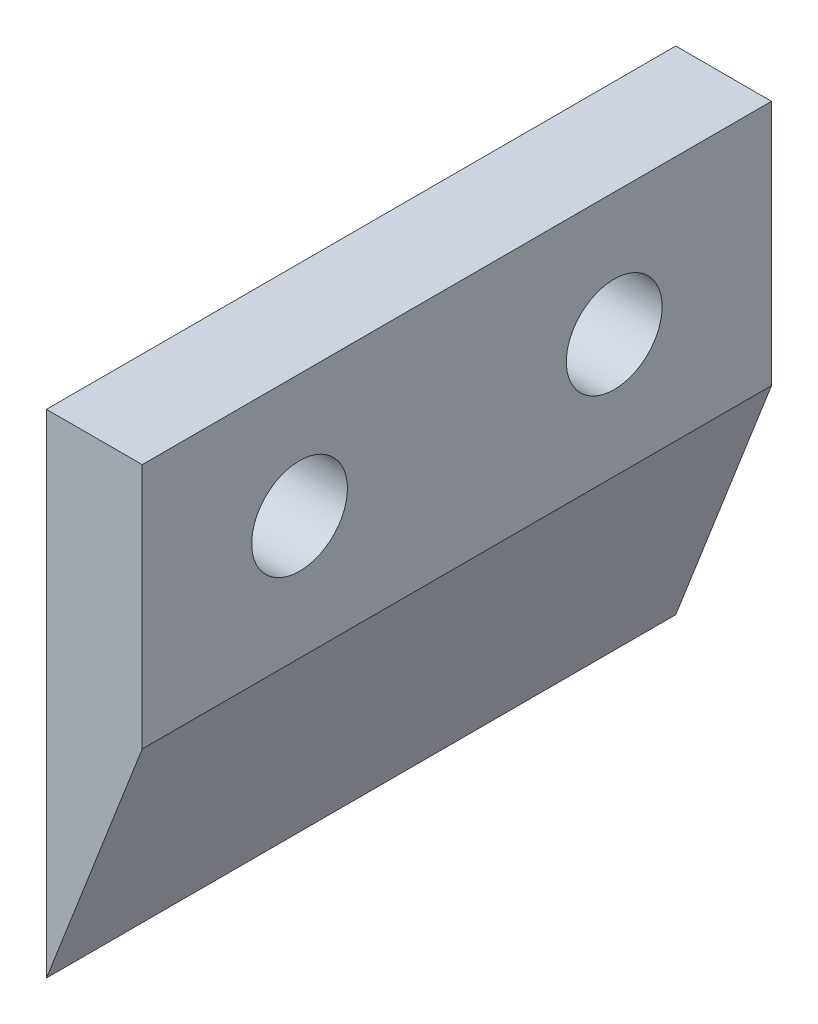
from build123d import *

# Parameters (mm, degrees)
SKETCH1_W           = 23
SKETCH1_H           = 18
BOSS_EXTRUDE1_DEPTH = 3.5
CUT_EXTRUDE1_DEPTH  = 30.41513216
SKETCH3_R           = 1.75
CUT_EXTRUDE3_DEPTH  = 30.41513216


with BuildPart() as part:
    # Sketch1 → Boss-Extrude1 (new body)
    with BuildSketch(Plane(origin=(0, 0, 0), x_dir=(0, 0, -1), z_dir=(1, 0, 0))):
        with Locations((11.5, 9)):
            Rectangle(SKETCH1_W, SKETCH1_H)
    extrude(amount=BOSS_EXTRUDE1_DEPTH)

    # Sketch2 → Cut-Extrude1 (cut, through all)
    with BuildSketch(Plane.XY):
        Polygon((3.5, 9), (0, 0), (3.5, 0), align=None)
    extrude(amount=-CUT_EXTRUDE1_DEPTH, mode=Mode.SUBTRACT)

    # Sketch3 → Cut-Extrude3 (cut, through all)
    with BuildSketch(Plane(origin=(3.5, 0, 0), x_dir=(0, 0, -1), z_dir=(1, 0, 0))):
        with Locations((5.75, 13.5)):
            Circle(SKETCH3_R)
        with Locations((17.25, 13.5)):
            Circle(SKETCH3_R)
    extrude(amount=-CUT_EXTRUDE3_DEPTH, mode=Mode.SUBTRACT)


solid = part.part
